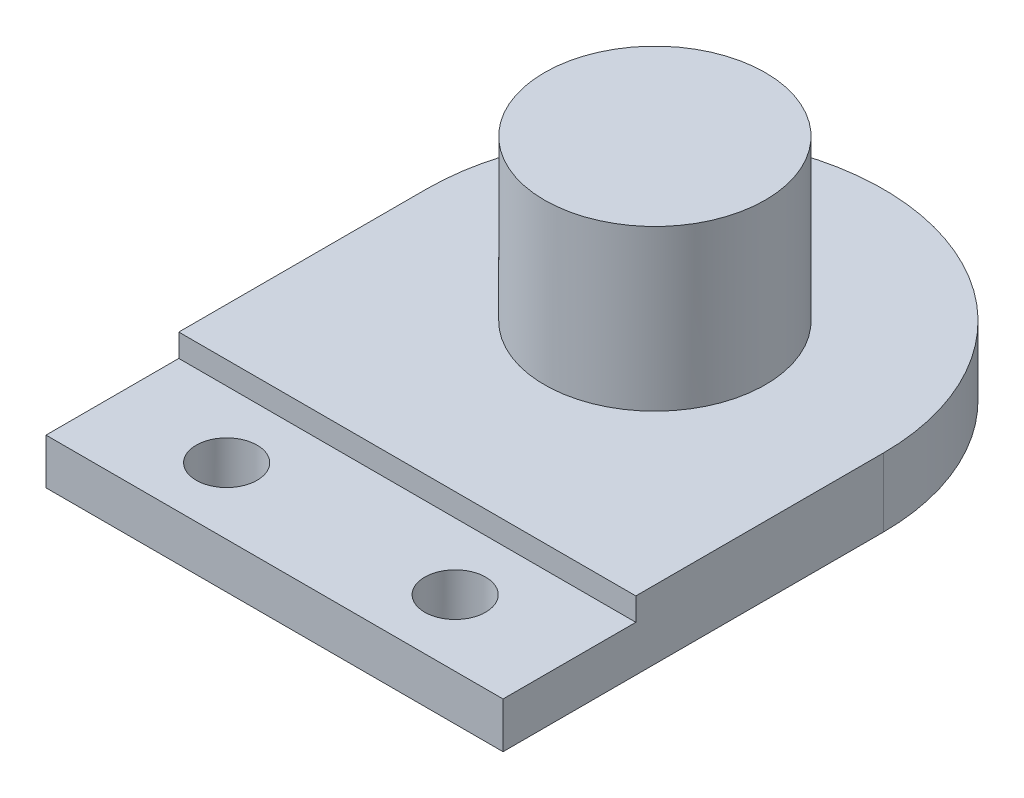
from build123d import *

# Parameters (mm, degrees)
BOSS_EXTRUDE1_DEPTH = 1.8
SKETCH3_W           = 12
SKETCH3_H           = 3.48629
CUT_EXTRUDE1_DEPTH  = 0.6
SKETCH4_R           = 2.9
BOSS_EXTRUDE2_DEPTH = 4.2
CUT_EXTRUDE2_REACH  = 22.557
SKETCH5_R           = 0.8


with BuildPart() as part:
    # Sketch2 → Boss-Extrude1 (new body)
    with BuildSketch(Plane(origin=(0, 0, 0), x_dir=(1, 0, 0), z_dir=(0, 1, 0))):
        with BuildLine():
            Line((0, 0), (0, 9.98629))
            ThreePointArc((0, 9.98629), (6, 15.98629), (12, 9.98629))
            Line((12, 9.98629), (12, 0))
            Line((12, 0), (0, 0))
        make_face()
    extrude(amount=BOSS_EXTRUDE1_DEPTH)

    # Sketch3 → Cut-Extrude1 (cut)
    with BuildSketch(Plane(origin=(0, 1.8, 0), x_dir=(1, 0, 0), z_dir=(0, 1, 0))):
        with Locations((6, 1.743145)):
            Rectangle(SKETCH3_W, SKETCH3_H)
    extrude(amount=-CUT_EXTRUDE1_DEPTH, mode=Mode.SUBTRACT)

    # Sketch4 → Boss-Extrude2 (add)
    with BuildSketch(Plane(origin=(0, 1.8, 0), x_dir=(1, 0, 0), z_dir=(0, 1, 0))):
        with Locations(Location((6, 9.98629, 0), (0, 0, 90))):
            Circle(SKETCH4_R)
    extrude(amount=BOSS_EXTRUDE2_DEPTH)

    # Sketch5 → Cut-Extrude2 (cut, up to next)
    with BuildSketch(Plane(origin=(0, 1.2, 0), x_dir=(1, 0, 0), z_dir=(0, 1, 0)), mode=Mode.PRIVATE) as cut_extrude2_sk1:
        with Locations(Location((3, 1.743145, 0), (0, 0, 270))):
            Circle(SKETCH5_R)
    cut_extrude2_tool1 = extrude(cut_extrude2_sk1.sketch, amount=-CUT_EXTRUDE2_REACH, mode=Mode.PRIVATE) & part.part
    # Sketch5 → Cut-Extrude2 (cut, up to next)
    with BuildSketch(Plane(origin=(0, 1.2, 0), x_dir=(1, 0, 0), z_dir=(0, 1, 0)), mode=Mode.PRIVATE) as cut_extrude2_sk2:
        with Locations(Location((9, 1.743145, 0), (0, 0, 270))):
            Circle(SKETCH5_R)
    cut_extrude2_tool2 = extrude(cut_extrude2_sk2.sketch, amount=-CUT_EXTRUDE2_REACH, mode=Mode.PRIVATE) & part.part
    add(cut_extrude2_tool1.solids().sort_by_distance((3, 1.2, -1.743145))[0], mode=Mode.SUBTRACT)
    add(cut_extrude2_tool2.solids().sort_by_distance((9, 1.2, -1.743145))[0], mode=Mode.SUBTRACT)


solid = part.part
